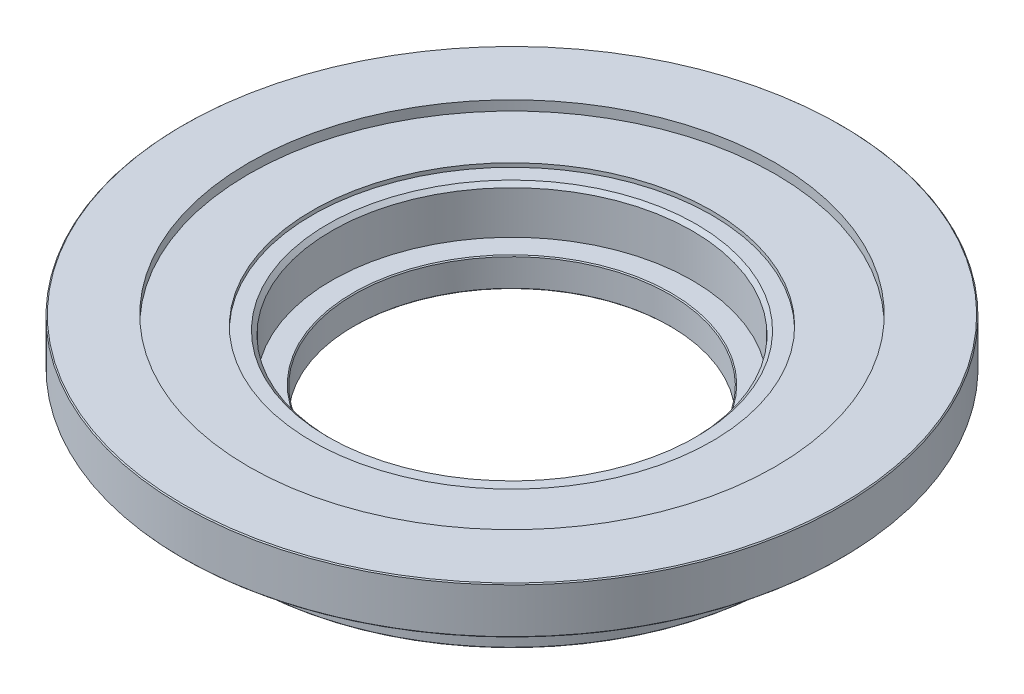
from build123d import *

# Parameters (mm, degrees)
SKETCH_1_W      = 169
SKETCH_1_H      = 24
SKETCH_2_R      = 137.5
EXTRUDE_1_DEPTH = 27
CHAMFER_1_SIZE  = 0.5
CHAMFER_2_SIZE  = 1.999999998
CHAMFER_2_SIZE2 = 2.000000002


with BuildPart() as part:
    # 草圖1 → 旋轉1 (revolve)
    with BuildSketch(Plane.XY, mode=Mode.PRIVATE) as revolve_1_sk:
        with Locations((84.5, 44)):
            Rectangle(SKETCH_1_W, SKETCH_1_H)
    revolve(revolve_1_sk.sketch.rotate(Axis((0, 56, 0), (0, -1, 0)), 270), axis=Axis((0, 56, 0), (0, -1, 0)))

    # 草圖2 → 填料-伸長1 (add)
    with BuildSketch(Plane.XZ.offset(-32)):
        with Locations(Location((0, 0, 0), (0, 0, 270))):
            Circle(SKETCH_2_R)
    extrude(amount=EXTRUDE_1_DEPTH)

    # 草圖3 → 除料-旋轉1 (revolve, cut)
    with BuildSketch(Plane.XY, mode=Mode.PRIVATE) as cut_revolve_1_sk:
        Polygon((135, 56), (0, 56), (0, 5), (132.5, 5), (132.5, 10), (81, 10), (81, 25), (92.5, 25), (92.5, 49), (102.5, 49), (102.5, 51), (135, 51), align=None)
    revolve(cut_revolve_1_sk.sketch.rotate(Axis((0, 56, 0), (0, -1, 0)), 270), axis=Axis((0, 56, 0), (0, -1, 0)), mode=Mode.SUBTRACT)

    # 導角1
    chamfer_1_edges = [part.edges().sort_by_distance(p)[0] for p in [
        (0, 5, 137.5),
        (0, 5, 132.5),
        (0, 10, 81),
        (0, 25, 81),
        (0, 32, 169),
        (0, 56, 169),
    ]]
    chamfer(chamfer_1_edges, length=CHAMFER_1_SIZE)

    # 導角2
    chamfer_2_edges = [part.edges().sort_by_distance(p)[0] for p in [
        (0, 49, 92.5),
    ]]
    chamfer_2_side = [part.faces().sort_by_distance(p)[0] for p in [
        (0, 49, 95.399137803),
    ]]
    chamfer(chamfer_2_edges, length=CHAMFER_2_SIZE, length2=CHAMFER_2_SIZE2, reference=chamfer_2_side[0])


solid = part.part
